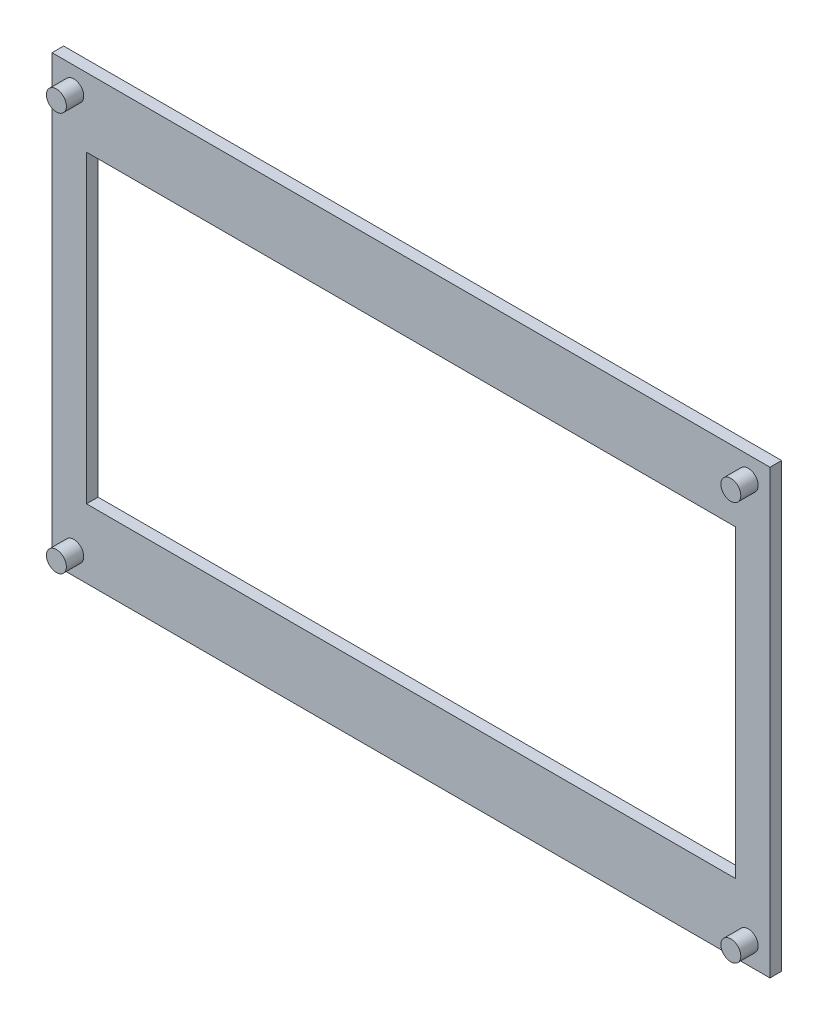
from build123d import *

# Parameters (mm, degrees)
SKETCH2_W           = 99
SKETCH2_H           = 61
SKETCH2_W_2         = 89.5
SKETCH2_H_2         = 42
BOSS_EXTRUDE1_DEPTH = 1.6
SKETCH3_R           = 1.375
BOSS_EXTRUDE2_DEPTH = 2.4


with BuildPart() as part:
    # Sketch2 → Boss-Extrude1 (new body)
    with BuildSketch(Plane.XY):
        with Locations((49.5, 30.5)):
            Rectangle(SKETCH2_W, SKETCH2_H)
        with Locations((49.5, 30.5)):
            Rectangle(SKETCH2_W_2, SKETCH2_H_2, mode=Mode.SUBTRACT)
    extrude(amount=-BOSS_EXTRUDE1_DEPTH)

    # Sketch3 → Boss-Extrude2 (add)
    with BuildSketch(Plane.XY):
        with Locations(Location((3, 58, 0), (0, 0, 180))):
            Circle(SKETCH3_R)
        with Locations(Location((96, 58, 0), (0, 0, 180))):
            Circle(SKETCH3_R)
        with Locations(Location((96, 3, 0), (0, 0, 180))):
            Circle(SKETCH3_R)
        with Locations(Location((3, 3, 0), (0, 0, 180))):
            Circle(SKETCH3_R)
    extrude(amount=BOSS_EXTRUDE2_DEPTH)


solid = part.part
